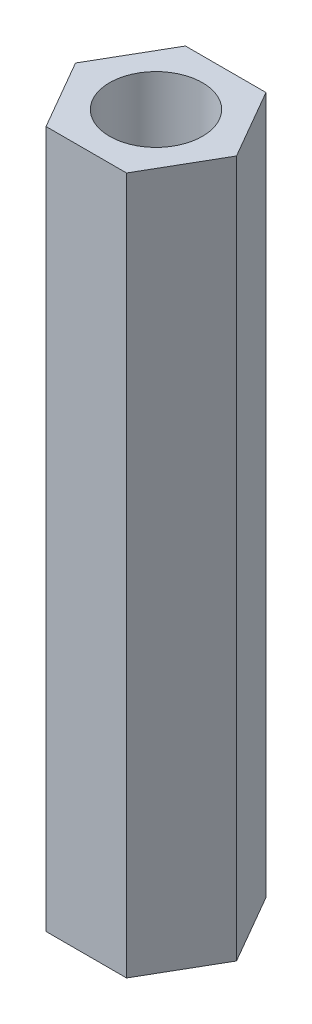
from build123d import *

# Parameters (mm, degrees)
SKETCH1_R           = 2
BOSS_EXTRUDE1_DEPTH = 30


with BuildPart() as part:
    # Sketch1 → Boss-Extrude1 (new body)
    with BuildSketch(Plane(origin=(0, 0, 0), x_dir=(1, 0, 0), z_dir=(0, 1, 0))):
        Polygon((3.464101615, 0), (1.732050808, 3), (-1.732050808, 3), (-3.464101615, 0), (-1.732050808, -3), (1.732050808, -3), align=None)
        with Locations(Location((0, 0, 0), (0, 0, 270))):
            Circle(SKETCH1_R, mode=Mode.SUBTRACT)
    extrude(amount=BOSS_EXTRUDE1_DEPTH)


solid = part.part
